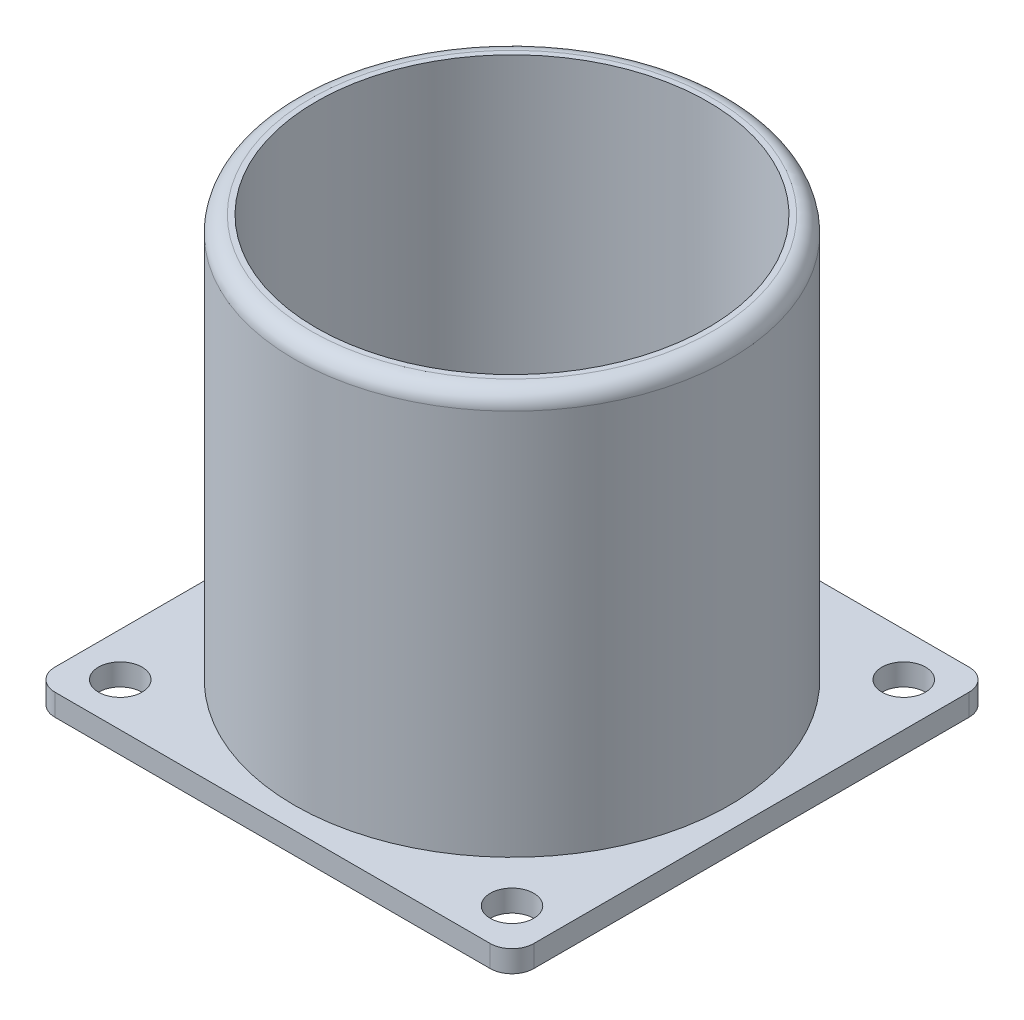
from build123d import *
from build123d.topology import SkipClean

# Parameters (mm, degrees)
ESBO_O1_W                = 44
ESBO_O1_H                = 44
RESSALTO_EXTRUS_O1_DEPTH = 2
ESBO_O3_R                = 20
ESBO_O3_R_2              = 18
RESSALTO_EXTRUS_O3_DEPTH = 37
FILETE3_R                = 1.5
FILETE4_R                = 2


with BuildPart() as part:
    # Esboço1 → Ressalto-extrusão1 (new body)
    with BuildSketch(Plane(origin=(0, 0, 0), x_dir=(1, 0, 0), z_dir=(0, 1, 0))):
        Rectangle(ESBO_O1_W, ESBO_O1_H)
        with BuildLine():
            ThreePointArc((-16, -18), (-19.658312395, -19.118033989), (-17.25, -16.145950378))
            ThreePointArc((-17.25, -16.145950378), (-16.341687605, -16.881966011), (-16, -18))
        make_face(mode=Mode.SUBTRACT)
        with BuildLine():
            ThreePointArc((-3.75, -17.605041891), (-4.50417298, -17.427347066), (-5.25, -17.217360425))
            Line((-5.25, -17.217360425), (-5.25, 17.217360425))
            ThreePointArc((-5.25, 17.217360425), (-4.50417298, 17.427347066), (-3.75, 17.605041891))
            Line((-3.75, 17.605041891), (-3.75, -17.605041891))
        make_face(mode=Mode.SUBTRACT)
        with BuildLine():
            ThreePointArc((20, -18), (16.881966011, -19.658312395), (17.25, -16.145950378))
            ThreePointArc((17.25, -16.145950378), (19.118033989, -16.341687605), (20, -18))
        make_face(mode=Mode.SUBTRACT)
        with BuildLine():
            ThreePointArc((-15.75, -8.714212529), (-16.596404379, -6.968454757), (-17.25, -5.14174095))
            Line((-17.25, -5.14174095), (-17.25, 5.14174095))
            ThreePointArc((-17.25, 5.14174095), (-16.596404379, 6.968454757), (-15.75, 8.714212529))
            Line((-15.75, 8.714212529), (-15.75, -8.714212529))
        make_face(mode=Mode.SUBTRACT)
        with BuildLine():
            ThreePointArc((-12.75, -12.70580576), (-13.527005163, -11.875189739), (-14.25, -10.997158724))
            Line((-14.25, -10.997158724), (-14.25, 10.997158724))
            ThreePointArc((-14.25, 10.997158724), (-13.527005163, 11.875189739), (-12.75, 12.70580576))
            Line((-12.75, 12.70580576), (-12.75, -12.70580576))
        make_face(mode=Mode.SUBTRACT)
        with BuildLine():
            ThreePointArc((-9.75, -15.130680751), (-10.513862046, -14.610226038), (-11.25, -14.051245496))
            Line((-11.25, -14.051245496), (-11.25, 14.051245496))
            ThreePointArc((-11.25, 14.051245496), (-10.513862046, 14.610226038), (-9.75, 15.130680751))
            Line((-9.75, 15.130680751), (-9.75, -15.130680751))
        make_face(mode=Mode.SUBTRACT)
        with BuildLine():
            ThreePointArc((-6.75, -16.686446596), (-7.507894085, -16.359447619), (-8.25, -15.998046756))
            Line((-8.25, -15.998046756), (-8.25, 15.998046756))
            ThreePointArc((-8.25, 15.998046756), (-7.507894085, 16.359447619), (-6.75, 16.686446596))
            Line((-6.75, 16.686446596), (-6.75, -16.686446596))
        make_face(mode=Mode.SUBTRACT)
        with BuildLine():
            Line((-0.75, 17.984368212), (-0.75, -17.984368212))
            ThreePointArc((-0.75, -17.984368212), (-1.501312927, -17.937281274), (-2.25, -17.85882135))
            Line((-2.25, -17.85882135), (-2.25, 17.85882135))
            ThreePointArc((-2.25, 17.85882135), (-1.501312927, 17.937281274), (-0.75, 17.984368212))
        make_face(mode=Mode.SUBTRACT)
        with BuildLine():
            ThreePointArc((-16, 18), (-16.341687605, 16.881966011), (-17.25, 16.145950378))
            ThreePointArc((-17.25, 16.145950378), (-19.658312395, 19.118033989), (-16, 18))
        make_face(mode=Mode.SUBTRACT)
        with BuildLine():
            ThreePointArc((2.25, -17.85882135), (1.501312927, -17.937281274), (0.75, -17.984368212))
            Line((0.75, -17.984368212), (0.75, 17.984368212))
            ThreePointArc((0.75, 17.984368212), (1.501312927, 17.937281274), (2.25, 17.85882135))
            Line((2.25, 17.85882135), (2.25, -17.85882135))
        make_face(mode=Mode.SUBTRACT)
        with BuildLine():
            ThreePointArc((5.25, -17.217360425), (4.50417298, -17.427347066), (3.75, -17.605041891))
            Line((3.75, -17.605041891), (3.75, 17.605041891))
            ThreePointArc((3.75, 17.605041891), (4.50417298, 17.427347066), (5.25, 17.217360425))
            Line((5.25, 17.217360425), (5.25, -17.217360425))
        make_face(mode=Mode.SUBTRACT)
        with BuildLine():
            ThreePointArc((8.25, -15.998046756), (7.507894085, -16.359447619), (6.75, -16.686446596))
            Line((6.75, -16.686446596), (6.75, 16.686446596))
            ThreePointArc((6.75, 16.686446596), (7.507894085, 16.359447619), (8.25, 15.998046756))
            Line((8.25, 15.998046756), (8.25, -15.998046756))
        make_face(mode=Mode.SUBTRACT)
        with BuildLine():
            ThreePointArc((11.25, -14.051245496), (10.513862046, -14.610226038), (9.75, -15.130680751))
            Line((9.75, -15.130680751), (9.75, 15.130680751))
            ThreePointArc((9.75, 15.130680751), (10.513862046, 14.610226038), (11.25, 14.051245496))
            Line((11.25, 14.051245496), (11.25, -14.051245496))
        make_face(mode=Mode.SUBTRACT)
        with BuildLine():
            ThreePointArc((14.25, -10.997158724), (13.527005163, -11.875189739), (12.75, -12.70580576))
            Line((12.75, -12.70580576), (12.75, 12.70580576))
            ThreePointArc((12.75, 12.70580576), (13.527005163, 11.875189739), (14.25, 10.997158724))
            Line((14.25, 10.997158724), (14.25, -10.997158724))
        make_face(mode=Mode.SUBTRACT)
        with BuildLine():
            ThreePointArc((17.25, -5.14174095), (16.596404379, -6.968454757), (15.75, -8.714212529))
            Line((15.75, -8.714212529), (15.75, 8.714212529))
            ThreePointArc((15.75, 8.714212529), (16.596404379, 6.968454757), (17.25, 5.14174095))
            Line((17.25, 5.14174095), (17.25, -5.14174095))
        make_face(mode=Mode.SUBTRACT)
        with BuildLine():
            ThreePointArc((20, 18), (19.118033989, 16.341687605), (17.25, 16.145950378))
            ThreePointArc((17.25, 16.145950378), (16.881966011, 19.658312395), (20, 18))
        make_face(mode=Mode.SUBTRACT)
    extrude(amount=RESSALTO_EXTRUS_O1_DEPTH)

    # Esboço3 → Ressalto-extrusão3 (add)
    with SkipClean():  # the faces are left unmerged after this step: merging them gives an invalid solid
        with BuildSketch(Plane(origin=(0, 2, 0), x_dir=(1, 0, 0), z_dir=(0, 1, 0))):
            with Locations(Location((0, 0, 0), (0, 0, 270))):
                Circle(ESBO_O3_R)
            with Locations(Location((0, 0, 0), (0, 0, 87.611984537))):
                Circle(ESBO_O3_R_2, mode=Mode.SUBTRACT)
        extrude(amount=RESSALTO_EXTRUS_O3_DEPTH)

    # Filete3
    filete3_edges = [part.edges().sort_by_distance(p)[0] for p in [
        (0, 39, -20),
    ]]
    fillet(filete3_edges, radius=FILETE3_R)

    # Filete4
    filete4_edges = [part.edges().sort_by_distance(p)[0] for p in [
        (-22, 1, 22),
        (-22, 1, -22),
        (22, 1, -22),
        (22, 1, 22),
    ]]
    fillet(filete4_edges, radius=FILETE4_R)


solid = part.part
